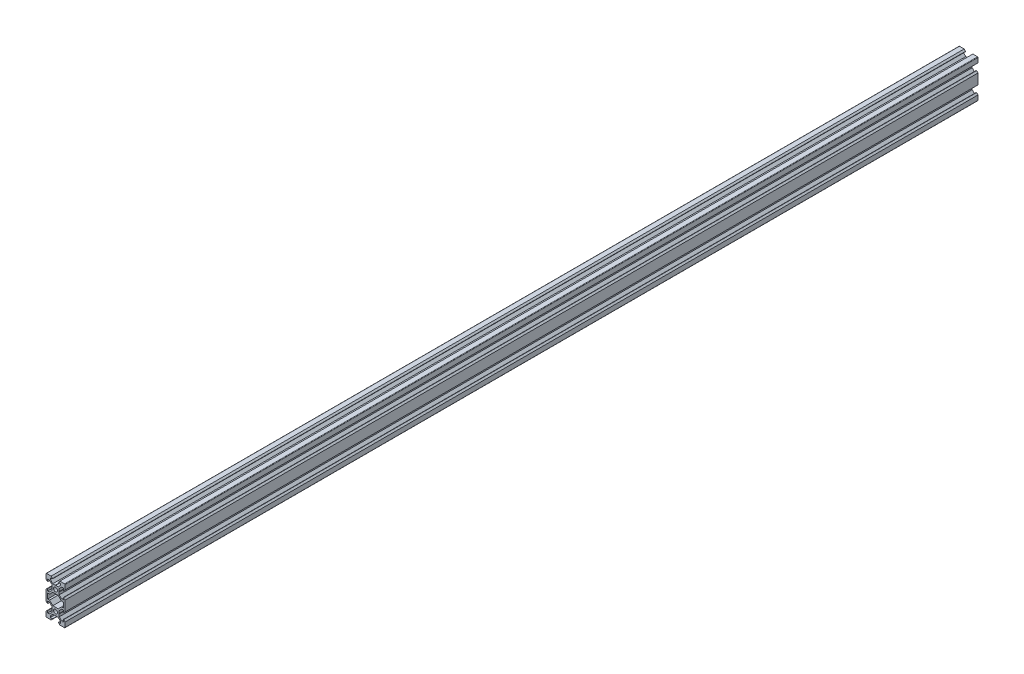
from build123d import *

# Parameters (mm, degrees)
SKETCH1_R           = 2.1
BOSS_EXTRUDE1_DEPTH = 960


with BuildPart() as part:
    # Sketch1 → Boss-Extrude1 (new body)
    with BuildSketch(Plane.XY.offset(1000)):
        with BuildLine():
            Line((6.560660172, 4.5), (3.9, 7.160660172))
            Line((3.9, 7.160660172), (3.9, 9.79))
            Line((3.9, 9.79), (3.69, 10))
            Line((3.69, 10), (3.9, 10.21))
            Line((3.9, 10.21), (3.9, 12.839339828))
            Line((3.9, 12.839339828), (6.560660172, 15.5))
            Line((6.560660172, 15.5), (8.2, 15.5))
            Line((8.2, 15.5), (8.2, 13.125))
            Line((8.2, 13.125), (8.545, 13.125))
            Line((8.545, 13.125), (10, 14.58))
            Line((10, 14.58), (10, 19.5))
            ThreePointArc((10, 19.5), (9.853553391, 19.853553391), (9.5, 20))
            Line((9.5, 20), (4.58, 20))
            Line((4.58, 20), (3.125, 18.545))
            Line((3.125, 18.545), (3.125, 18.2))
            Line((3.125, 18.2), (5.5, 18.2))
            Line((5.5, 18.2), (5.5, 16.560660172))
            Line((5.5, 16.560660172), (2.839339828, 13.9))
            Line((2.839339828, 13.9), (0.21, 13.9))
            Line((0.21, 13.9), (0, 13.69))
            Line((0, 13.69), (-0.21, 13.9))
            Line((-0.21, 13.9), (-2.839339828, 13.9))
            Line((-2.839339828, 13.9), (-5.5, 16.560660172))
            Line((-5.5, 16.560660172), (-5.5, 18.2))
            Line((-5.5, 18.2), (-3.125, 18.2))
            Line((-3.125, 18.2), (-3.125, 18.545))
            Line((-3.125, 18.545), (-4.58, 20))
            Line((-4.58, 20), (-9.5, 20))
            ThreePointArc((-9.5, 20), (-9.853553391, 19.853553391), (-10, 19.5))
            Line((-10, 19.5), (-10, 14.58))
            Line((-10, 14.58), (-8.545, 13.125))
            Line((-8.545, 13.125), (-8.2, 13.125))
            Line((-8.2, 13.125), (-8.2, 15.5))
            Line((-8.2, 15.5), (-6.560660172, 15.5))
            Line((-6.560660172, 15.5), (-3.9, 12.839339828))
            Line((-3.9, 12.839339828), (-3.9, 10.21))
            Line((-3.9, 10.21), (-3.69, 10))
            Line((-3.69, 10), (-3.9, 9.79))
            Line((-3.9, 9.79), (-3.9, 7.160660172))
            Line((-3.9, 7.160660172), (-6.560660172, 4.5))
            Line((-6.560660172, 4.5), (-8.2, 4.5))
            Line((-8.2, 4.5), (-8.2, 6.875))
            Line((-8.2, 6.875), (-8.545, 6.875))
            Line((-8.545, 6.875), (-10, 5.42))
            Line((-10, 5.42), (-10, -5.42))
            Line((-10, -5.42), (-8.545, -6.875))
            Line((-8.545, -6.875), (-8.2, -6.875))
            Line((-8.2, -6.875), (-8.2, -4.5))
            Line((-8.2, -4.5), (-6.560660172, -4.5))
            Line((-6.560660172, -4.5), (-3.9, -7.160660172))
            Line((-3.9, -7.160660172), (-3.9, -9.79))
            Line((-3.9, -9.79), (-3.69, -10))
            Line((-3.69, -10), (-3.9, -10.21))
            Line((-3.9, -10.21), (-3.9, -12.839339828))
            Line((-3.9, -12.839339828), (-6.560660172, -15.5))
            Line((-6.560660172, -15.5), (-8.2, -15.5))
            Line((-8.2, -15.5), (-8.2, -13.125))
            Line((-8.2, -13.125), (-8.545, -13.125))
            Line((-8.545, -13.125), (-10, -14.58))
            Line((-10, -14.58), (-10, -19.5))
            ThreePointArc((-10, -19.5), (-9.853553391, -19.853553391), (-9.5, -20))
            Line((-9.5, -20), (-4.58, -20))
            Line((-4.58, -20), (-3.125, -18.545))
            Line((-3.125, -18.545), (-3.125, -18.2))
            Line((-3.125, -18.2), (-5.5, -18.2))
            Line((-5.5, -18.2), (-5.5, -16.560660172))
            Line((-5.5, -16.560660172), (-2.839339828, -13.9))
            Line((-2.839339828, -13.9), (-0.21, -13.9))
            Line((-0.21, -13.9), (0, -13.69))
            Line((0, -13.69), (0.21, -13.9))
            Line((0.21, -13.9), (2.839339828, -13.9))
            Line((2.839339828, -13.9), (5.5, -16.560660172))
            Line((5.5, -16.560660172), (5.5, -18.2))
            Line((5.5, -18.2), (3.125, -18.2))
            Line((3.125, -18.2), (3.125, -18.545))
            Line((3.125, -18.545), (4.58, -20))
            Line((4.58, -20), (9.5, -20))
            ThreePointArc((9.5, -20), (9.853553391, -19.853553391), (10, -19.5))
            Line((10, -19.5), (10, -14.58))
            Line((10, -14.58), (8.545, -13.125))
            Line((8.545, -13.125), (8.2, -13.125))
            Line((8.2, -13.125), (8.2, -15.5))
            Line((8.2, -15.5), (6.560660172, -15.5))
            Line((6.560660172, -15.5), (3.9, -12.839339828))
            Line((3.9, -12.839339828), (3.9, -10.21))
            Line((3.9, -10.21), (3.69, -10))
            Line((3.69, -10), (3.9, -9.79))
            Line((3.9, -9.79), (3.9, -7.160660172))
            Line((3.9, -7.160660172), (6.560660172, -4.5))
            Line((6.560660172, -4.5), (8.2, -4.5))
            Line((8.2, -4.5), (8.2, -6.875))
            Line((8.2, -6.875), (8.545, -6.875))
            Line((8.545, -6.875), (10, -5.42))
            Line((10, -5.42), (10, 5.42))
            Line((10, 5.42), (8.545, 6.875))
            Line((8.545, 6.875), (8.2, 6.875))
            Line((8.2, 6.875), (8.2, 4.5))
            Line((8.2, 4.5), (6.560660172, 4.5))
        make_face()
        with Locations(Location((0, 10, 0), (0, 0, 180))):
            Circle(SKETCH1_R, mode=Mode.SUBTRACT)
        with Locations(Location((0, -10, 0), (0, 0, 180))):
            Circle(SKETCH1_R, mode=Mode.SUBTRACT)
        Polygon((2.839339828, -6.1), (-2.839339828, -6.1), (-6.239339828, -2.7), (-8.2, -2.7), (-8.2, 2.7), (-6.239339828, 2.7), (-2.839339828, 6.1), (2.839339828, 6.1), (6.239339828, 2.7), (8.2, 2.7), (8.2, -2.7), (6.239339828, -2.7), align=None, mode=Mode.SUBTRACT)
    extrude(amount=-BOSS_EXTRUDE1_DEPTH)


solid = part.part
